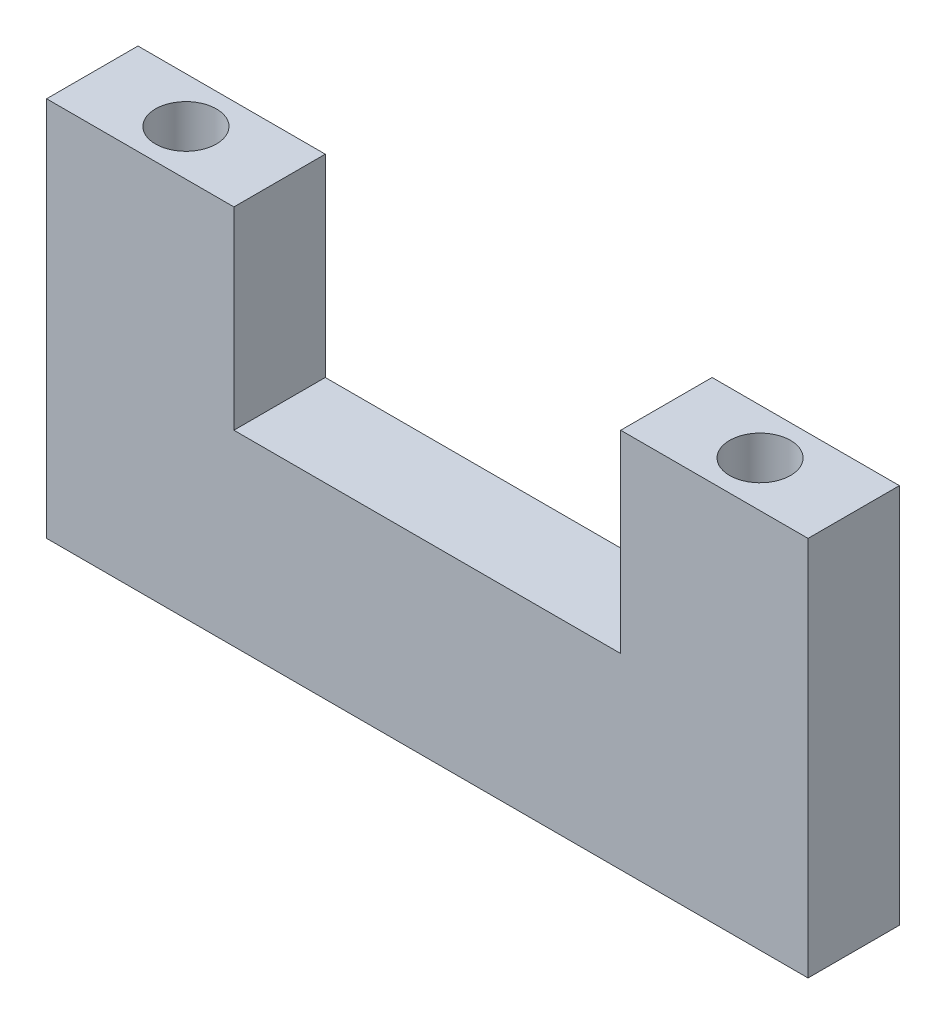
from build123d import *

# Parameters (mm, degrees)
SKETCH1_W           = 25
SKETCH1_H           = 12.5
BOSS_EXTRUDE1_DEPTH = 3
SKETCH2_W           = 12.7
SKETCH2_H           = 6.35
CUT_EXTRUDE1_DEPTH  = 3
SKETCH3_R           = 1
CUT_EXTRUDE2_DEPTH  = 5
SKETCH4_R           = 1
CUT_EXTRUDE3_DEPTH  = 5


with BuildPart() as part:
    # Sketch1 → Boss-Extrude1 (new body)
    with BuildSketch(Plane.XY):
        Rectangle(SKETCH1_W, SKETCH1_H)
    extrude(amount=BOSS_EXTRUDE1_DEPTH)

    # Sketch2 → Cut-Extrude1 (cut)
    with BuildSketch(Plane.XY.offset(3)):
        with Locations((0, 3.075)):
            Rectangle(SKETCH2_W, SKETCH2_H)
    extrude(amount=-CUT_EXTRUDE1_DEPTH, mode=Mode.SUBTRACT)

    # Sketch3 → Cut-Extrude2 (cut)
    with BuildSketch(Plane(origin=(0, 6.25, 0), x_dir=(1, 0, 0), z_dir=(0, 1, 0))):
        with Locations(Location((-9.425, -1.5, 0), (0, 0, 270))):
            Circle(SKETCH3_R)
    extrude(amount=-CUT_EXTRUDE2_DEPTH, mode=Mode.SUBTRACT)

    # Sketch4 → Cut-Extrude3 (cut)
    with BuildSketch(Plane(origin=(0, 6.25, 0), x_dir=(1, 0, 0), z_dir=(0, 1, 0))):
        with Locations(Location((9.425, -1.5, 0), (0, 0, 270))):
            Circle(SKETCH4_R)
    extrude(amount=-CUT_EXTRUDE3_DEPTH, mode=Mode.SUBTRACT)


solid = part.part
